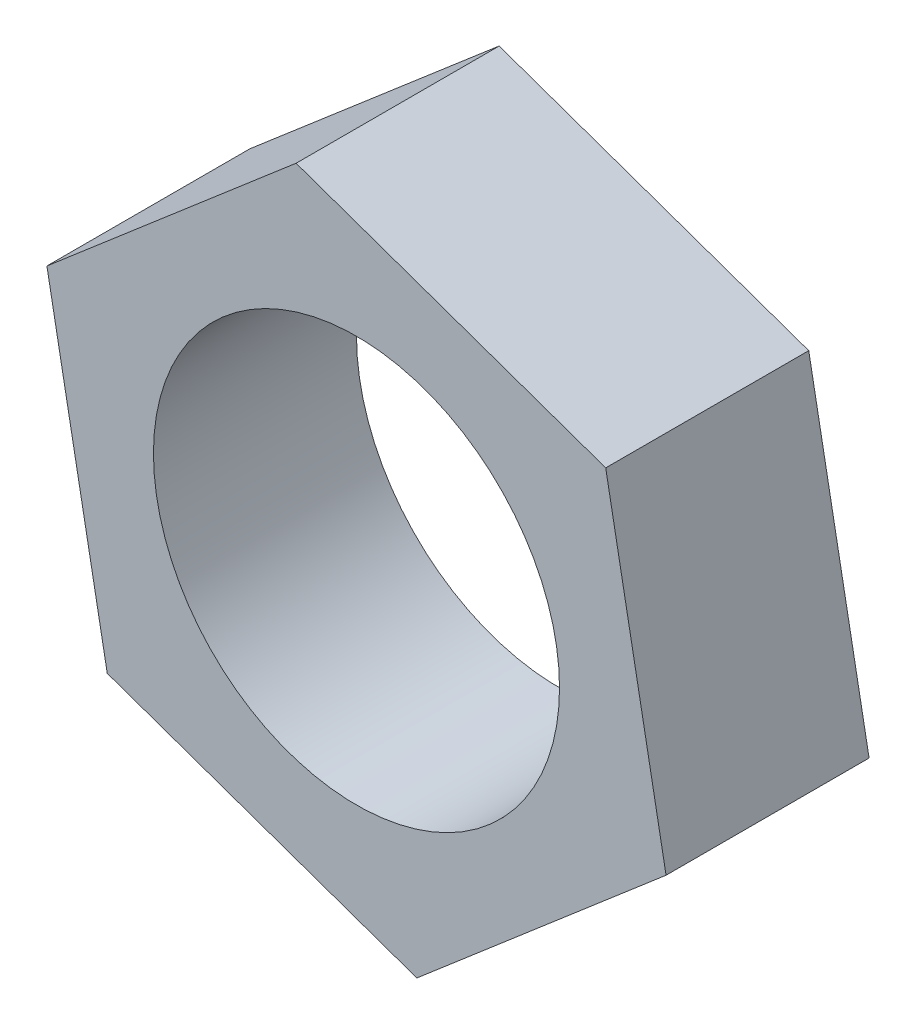
from build123d import *

# Parameters (mm, degrees)
SKETCH1_R           = 5
BOSS_EXTRUDE1_DEPTH = 2.5


with BuildPart() as part:
    # Sketch1 → Boss-Extrude1 (new, symmetric)
    with BuildSketch(Plane.XY):
        Polygon((1.486420037, -7.945054361), (7.62382893, -2.685249668), (6.137408893, 5.259804694), (-1.486420037, 7.945054361), (-7.62382893, 2.685249668), (-6.137408893, -5.259804694), align=None)
        Circle(SKETCH1_R, mode=Mode.SUBTRACT)
    extrude(amount=BOSS_EXTRUDE1_DEPTH, both=True)


solid = part.part
